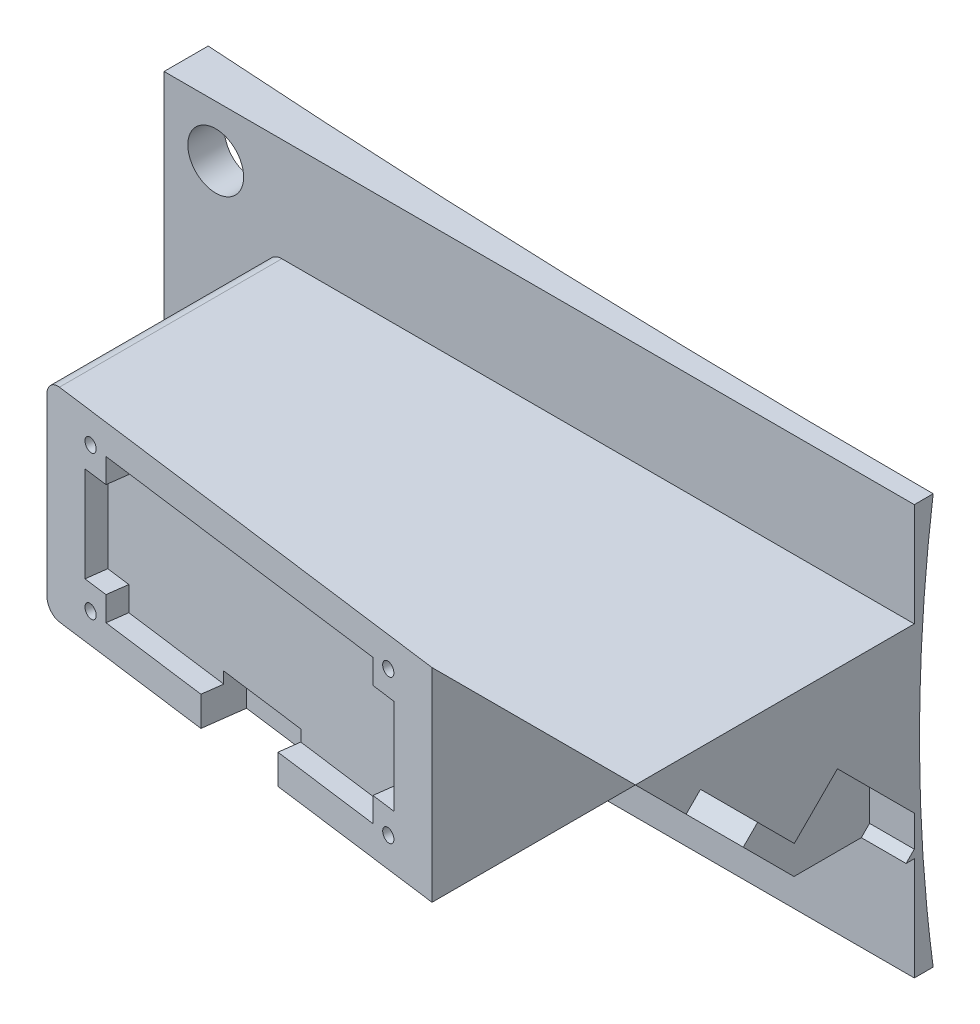
from build123d import *

# Parameters (mm, degrees)
BOSS_EXTRUDE4_DEPTH           = 25
CUT_EXTRUDE2_DEPTH            = 25
TAP_DRILL_FOR_4_40_TAP1_D     = 1.600000102
TAP_DRILL_FOR_4_40_TAP1_DEPTH = 7.874
TAP_DRILL_FOR_4_40_TAP1_TIP   = 0.480688526
TAP_DRILL_FOR_4_40_TAP3_D     = 1.600000102
TAP_DRILL_FOR_4_40_TAP3_DEPTH = 7.874
TAP_DRILL_FOR_4_40_TAP3_TIP   = 0.480688526
TAP_DRILL_FOR_4_40_TAP4_D     = 1.600000102
TAP_DRILL_FOR_4_40_TAP4_DEPTH = 7.874
TAP_DRILL_FOR_4_40_TAP4_TIP   = 0.480688526
FILLET1_R                     = 1.778
CUT_EXTRUDE3_DEPTH            = 2.5
CUT_EXTRUDE4_DEPTH            = 2.5
CUT_EXTRUDE5_DEPTH            = 2.5
SKETCH23_W                    = 11
SKETCH23_H                    = 5.045
CUT_EXTRUDE6_DEPTH            = 5
SKETCH24_W                    = 11
SKETCH24_H                    = 5.045
CUT_EXTRUDE7_DEPTH            = 5
SKETCH25_W                    = 11
SKETCH25_H                    = 16.07506189
CUT_EXTRUDE8_DEPTH            = 10
SKETCH26_W                    = 184.458934752
SKETCH26_H                    = 50.4
BOSS_EXTRUDE6_DEPTH           = 29.21
SKETCH27_R                    = 3.429
CUT_EXTRUDE9_DEPTH            = 106.37252383
SKETCH28_W                    = 213.421600351
SKETCH28_H                    = 165.256924626
CUT_EXTRUDE10_DEPTH           = 119.151659651


with BuildPart() as part:
    # Sketch6 → Boss-Extrude4 (new body)
    with BuildSketch(Plane(origin=(0, 0, 0), x_dir=(1, 0, 0), z_dir=(0, 1, 0))):
        Polygon((-79.529467376, 0), (79.529467376, 0), (79.529467376, -56.321059428), (25, -63.5), (-25, -63.5), (-79.529467376, -56.321059428), align=None)
    extrude(amount=BOSS_EXTRUDE4_DEPTH)

    # Sketch7 → Cut-Extrude2 (cut, symmetric)
    with BuildSketch(Plane(origin=(0, 0, 0), x_dir=(0, 0, -1), z_dir=(1, 0, 0))):
        Polygon((-63.5, 25), (-38.5, 0), (-63.5, 0), align=None)
    extrude(amount=CUT_EXTRUDE2_DEPTH, both=True, mode=Mode.SUBTRACT)

    # Tap Drill for #4-40 Tap1
    with Locations(Plane(origin=(0, -19.25, 19.25), x_dir=(-1, 0, 0), z_dir=(0, -0.7071067811865488, 0.7071067811865462))):
        with Locations((-21.255000035, -53.756280605), (21.255000035, -53.756280605), (21.255000035, -36.046280605), (-21.255000035, -36.046280605)):
            Hole(TAP_DRILL_FOR_4_40_TAP1_D / 2, depth=TAP_DRILL_FOR_4_40_TAP1_DEPTH)
            with Locations((0, 0, -(TAP_DRILL_FOR_4_40_TAP1_DEPTH + TAP_DRILL_FOR_4_40_TAP1_TIP / 2))):  # 118° drill point
                Cone(0, TAP_DRILL_FOR_4_40_TAP1_D / 2, TAP_DRILL_FOR_4_40_TAP1_TIP, mode=Mode.SUBTRACT)

    # Tap Drill for #4-40 Tap3
    with Locations(Plane(origin=(-8.643431853, 0, 65.653383048), x_dir=(0.9914448613738104, 0, 0.13052619222005213), z_dir=(-0.13052619222005213, 0, 0.9914448613738104))):
        with Locations((-65.252708328, 21.355), (-22.742708328, 21.355), (-22.742708328, 3.645), (-65.252708328, 3.645)):
            Hole(TAP_DRILL_FOR_4_40_TAP3_D / 2, depth=TAP_DRILL_FOR_4_40_TAP3_DEPTH)
            with Locations((0, 0, -(TAP_DRILL_FOR_4_40_TAP3_DEPTH + TAP_DRILL_FOR_4_40_TAP3_TIP / 2))):  # 118° drill point
                Cone(0, TAP_DRILL_FOR_4_40_TAP3_D / 2, TAP_DRILL_FOR_4_40_TAP3_TIP, mode=Mode.SUBTRACT)

    # Tap Drill for #4-40 Tap4
    with Locations(Plane(origin=(8.643431853, 0, 65.653383048), x_dir=(0.9914448613738104, 0, -0.13052619222005213), z_dir=(0.13052619222005213, 0, 0.9914448613738104))):
        with Locations((22.742708328, 21.355), (65.252708328, 21.355), (65.252708328, 3.645), (22.742708328, 3.645)):
            Hole(TAP_DRILL_FOR_4_40_TAP4_D / 2, depth=TAP_DRILL_FOR_4_40_TAP4_DEPTH)
            with Locations((0, 0, -(TAP_DRILL_FOR_4_40_TAP4_DEPTH + TAP_DRILL_FOR_4_40_TAP4_TIP / 2))):  # 118° drill point
                Cone(0, TAP_DRILL_FOR_4_40_TAP4_D / 2, TAP_DRILL_FOR_4_40_TAP4_TIP, mode=Mode.SUBTRACT)

    # Fillet1
    fillet1_edges = [part.edges().sort_by_distance(p)[0] for p in [
        (-79.529467376, 25, 28.160529714),
        (79.529467376, 25, 28.160529714),
        (-79.529467376, 0, 28.160529714),
        (79.529467376, 0, 28.160529714),
    ]]
    fillet(fillet1_edges, radius=FILLET1_R)

    # Sketch22 → Cut-Extrude3 (cut)
    with BuildSketch(Plane(origin=(0, -19.25, 19.25), x_dir=(1, 0, 0), z_dir=(0, -0.7071067811865488, 0.7071067811865462))):
        Polygon((-19.055000086, 53.756280605), (-19.055000086, 50.756280605), (-22.055000086, 50.756280605), (-22.055000086, 39.046280605), (-19.055000086, 39.046280605), (-19.055000086, 36.046280605), (19.055000086, 36.046280605), (19.055000086, 39.046280605), (22.055000086, 39.046280605), (22.055000086, 50.756280605), (19.055000086, 50.756280605), (19.055000086, 53.756280605), align=None)
    extrude(amount=-CUT_EXTRUDE3_DEPTH, mode=Mode.SUBTRACT)

    # Sketch21 → Cut-Extrude4 (cut)
    with BuildSketch(Plane(origin=(8.643431853, 0, 65.653383048), x_dir=(0.9914448613738104, 0, -0.13052619222005213), z_dir=(0.13052619222005213, 0, 0.9914448613738104))):
        Polygon((24.942708277, 21.355), (24.942708277, 18.355), (21.942708277, 18.355), (21.942708277, 6.645), (24.942708277, 6.645), (24.942708277, 3.645), (63.052708379, 3.645), (63.052708379, 6.645), (66.052708379, 6.645), (66.052708379, 18.355), (63.052708379, 18.355), (63.052708379, 21.355), align=None)
    extrude(amount=-CUT_EXTRUDE4_DEPTH, mode=Mode.SUBTRACT)

    # Sketch20 → Cut-Extrude5 (cut)
    with BuildSketch(Plane(origin=(-8.643431853, 0, 65.653383048), x_dir=(0.9914448613738104, 0, 0.13052619222005213), z_dir=(-0.13052619222005213, 0, 0.9914448613738104))):
        Polygon((-63.052708379, 21.355), (-63.052708379, 18.355), (-66.052708379, 18.355), (-66.052708379, 6.645), (-63.052708379, 6.645), (-63.052708379, 3.645), (-24.942708277, 3.645), (-24.942708277, 6.645), (-21.942708277, 6.645), (-21.942708277, 18.355), (-24.942708277, 18.355), (-24.942708277, 21.355), align=None)
    extrude(amount=-CUT_EXTRUDE5_DEPTH, mode=Mode.SUBTRACT)

    # Sketch23 → Cut-Extrude6 (cut)
    with BuildSketch(Plane(origin=(8.643431853, 0, 65.653383048), x_dir=(0.9914448613738104, 0, -0.13052619222005213), z_dir=(0.13052619222005213, 0, 0.9914448613738104))):
        with Locations((43.997708328, 2.5225)):
            Rectangle(SKETCH23_W, SKETCH23_H)
    extrude(amount=-CUT_EXTRUDE6_DEPTH, mode=Mode.SUBTRACT)

    # Sketch24 → Cut-Extrude7 (cut)
    with BuildSketch(Plane(origin=(-8.643431853, 0, 65.653383048), x_dir=(0.9914448613738104, 0, 0.13052619222005213), z_dir=(-0.13052619222005213, 0, 0.9914448613738104))):
        with Locations((-43.997708328, 2.5225)):
            Rectangle(SKETCH24_W, SKETCH24_H)
    extrude(amount=-CUT_EXTRUDE7_DEPTH, mode=Mode.SUBTRACT)

    # Sketch25 → Cut-Extrude8 (cut)
    with BuildSketch(Plane(origin=(0, -19.25, 19.25), x_dir=(1, 0, 0), z_dir=(0, -0.7071067811865488, 0.7071067811865462))):
        with Locations((0, 29.40874966)):
            Rectangle(SKETCH25_W, SKETCH25_H)
    extrude(amount=-CUT_EXTRUDE8_DEPTH, mode=Mode.SUBTRACT)

    # Sketch26 → Boss-Extrude6 (add)
    with BuildSketch(Plane(origin=(0, 0, 0), x_dir=(-1, 0, 0), z_dir=(0, 0, -1))):
        with Locations((0, 12.5)):
            Rectangle(SKETCH26_W, SKETCH26_H)
    extrude(amount=-BOSS_EXTRUDE6_DEPTH)

    # Sketch11 → Cut-Revolve4 (revolve, cut)
    with BuildSketch(Plane(origin=(0, 0, 0), x_dir=(0, 0, -1), z_dir=(1, 0, 0))):
        with BuildLine():
            Line((1344.295, -496.77), (1344.295, 521.77))
            add(Edge.make_bspline(
                [(1344.295, 521.77), (-28.575, 521.77), (-28.575, 12.5), (-28.575, -496.77), (1344.295, -496.77)],
                knots=[4.71238898, 4.71238898, 4.71238898, 6.283185307, 6.283185307, 7.853981634, 7.853981634, 7.853981634], degree=2, weights=[1, 0.707106781, 1, 0.707106781, 1]))
        make_face()
    revolve(axis=Axis((0, -496.77, -1344.295), (0, 1, 0)), mode=Mode.SUBTRACT)

    # Sketch27 → Cut-Extrude9 (cut, through all)
    with BuildSketch(Plane.XY.offset(29.21)):
        with Locations((85.879467376, -6.35)):
            Circle(SKETCH27_R)
        with Locations((-85.879467376, -6.35)):
            Circle(SKETCH27_R)
        with Locations((-85.879467376, 31.35)):
            Circle(SKETCH27_R)
        with Locations((85.879467376, 31.35)):
            Circle(SKETCH27_R)
    extrude(amount=-CUT_EXTRUDE9_DEPTH, mode=Mode.SUBTRACT)

    # Sketch28 → Cut-Extrude10 (cut, through all)
    with BuildSketch(Plane(origin=(0, 0, 0), x_dir=(0, 0, -1), z_dir=(1, 0, 0))):
        with Locations((-88.614526188, -30.502194162)):
            Rectangle(SKETCH28_W, SKETCH28_H)
    extrude(amount=CUT_EXTRUDE10_DEPTH, mode=Mode.SUBTRACT)


solid = part.part
